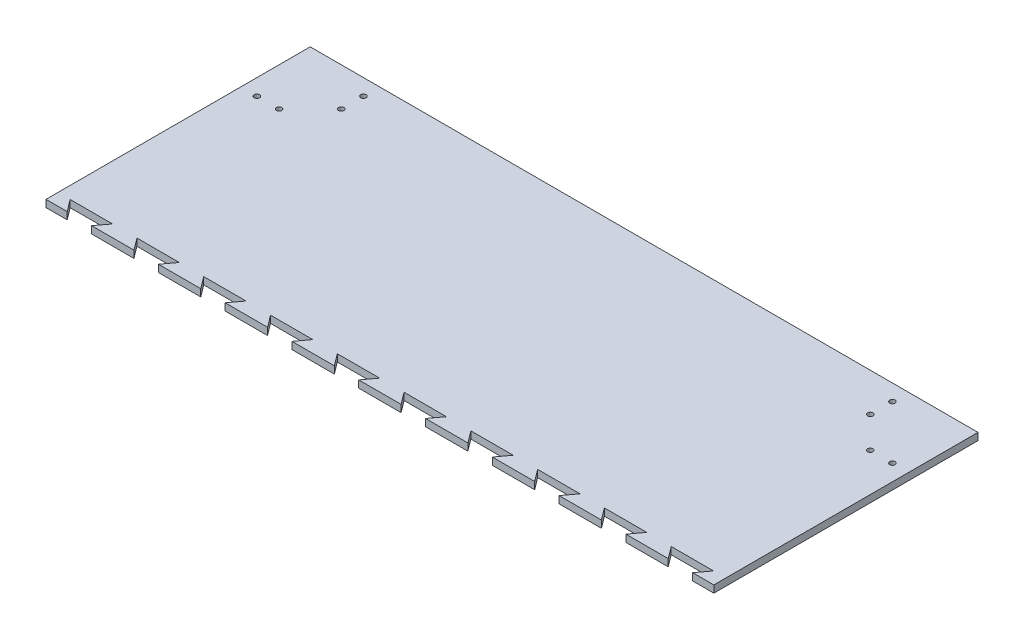
from build123d import *

# Parameters (mm, degrees)
SCHIZZO1_W                   = 558
SCHIZZO1_H                   = 441.5
ESTRUSIONE_ESTRUSIONE1_DEPTH = 6
SCHIZZO2_R                   = 2.25
TAGLIO_ESTRUSIONE1_DEPTH     = 10
TAGLIO_ESTRUSIONE2_DEPTH     = 10


with BuildPart() as part:
    # Schizzo1 → Estrusione-Estrusione1 (new body)
    with BuildSketch(Plane(origin=(0, 0, 0), x_dir=(1, 0, 0), z_dir=(0, 1, 0))):
        Rectangle(SCHIZZO1_W, SCHIZZO1_H)
    extrude(amount=ESTRUSIONE_ESTRUSIONE1_DEPTH)

    # Schizzo2 → Taglio-Estrusione1 (cut)
    with BuildSketch(Plane(origin=(0, 0, 0), x_dir=(-1, 0, 0), z_dir=(0, -1, 0))):
        with Locations(Location((-221, 207.25, 0), (0, 0, 90))):
            Circle(SCHIZZO2_R)
        with Locations(Location((-221, 188.75, 0), (0, 0, 90))):
            Circle(SCHIZZO2_R)
        with Locations(Location((-247, 162.75, 0), (0, 0, 90))):
            Circle(SCHIZZO2_R)
        with Locations(Location((-265.5, 162.75, 0), (0, 0, 90))):
            Circle(SCHIZZO2_R)
        with Locations(Location((221, 207.25, 0), (0, 0, 90))):
            Circle(SCHIZZO2_R)
        with Locations(Location((221, 188.75, 0), (0, 0, 90))):
            Circle(SCHIZZO2_R)
        with Locations(Location((247, 162.75, 0), (0, 0, 90))):
            Circle(SCHIZZO2_R)
        with Locations(Location((265.5, 162.75, 0), (0, 0, 90))):
            Circle(SCHIZZO2_R)
        with Locations(Location((265.5, -162.75, 0), (0, 0, 90))):
            Circle(SCHIZZO2_R)
        with Locations(Location((247, -162.75, 0), (0, 0, 90))):
            Circle(SCHIZZO2_R)
        with Locations(Location((-265.5, -162.75, 0), (0, 0, 90))):
            Circle(SCHIZZO2_R)
        with Locations(Location((-247, -162.75, 0), (0, 0, 90))):
            Circle(SCHIZZO2_R)
        with Locations(Location((-87.5, -195.25, 0), (0, 0, 90))):
            Circle(SCHIZZO2_R)
    extrude(amount=-TAGLIO_ESTRUSIONE1_DEPTH, mode=Mode.SUBTRACT)

    # Schizzo3 → Taglio-Estrusione2 (cut)
    with BuildSketch(Plane(origin=(0, 6, 0), x_dir=(1, 0, 0), z_dir=(0, 1, 0))):
        Polygon((-279, 0), (-261.3, 0), (-268.8, 10), (-233.4, 10), (-240.9, 0), (-223.2, 0), (-205.5, 0), (-213, 10), (-177.6, 10), (-185.1, 0), (-167.4, 0), (-149.7, 0), (-157.2, 10), (-121.8, 10), (-129.3, 0), (-111.6, 0), (-93.9, 0), (-101.4, 10), (-66, 10), (-73.5, 0), (-55.8, 0), (-38.1, 0), (-45.6, 10), (-10.2, 10), (-17.7, 0), (0, 0), (17.7, 0), (10.2, 10), (45.6, 10), (38.1, 0), (55.8, 0), (73.5, 0), (66, 10), (101.4, 10), (93.9, 0), (111.6, 0), (129.3, 0), (121.8, 10), (157.2, 10), (149.7, 0), (167.4, 0), (185.1, 0), (177.6, 10), (213, 10), (205.5, 0), (223.2, 0), (240.9, 0), (233.4, 10), (268.8, 10), (261.3, 0), (279, 0), (279, -220.75), (-279, -220.75), align=None)
    extrude(amount=-TAGLIO_ESTRUSIONE2_DEPTH, mode=Mode.SUBTRACT)


solid = part.part
